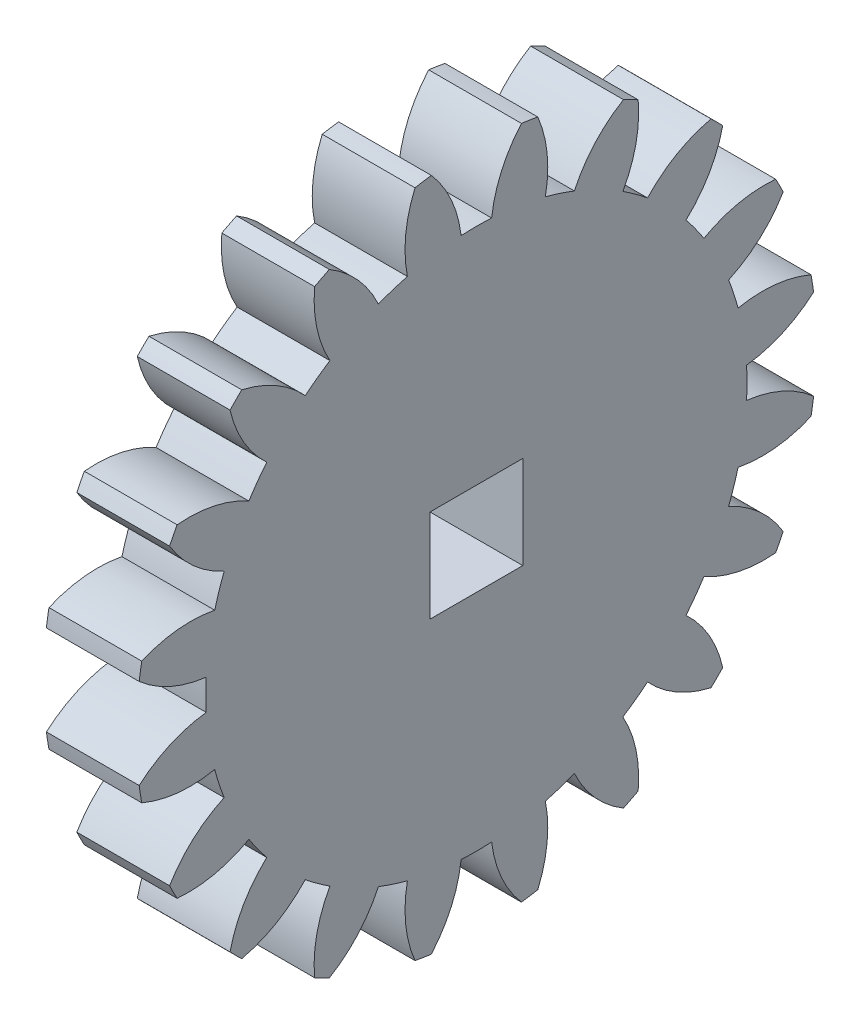
from build123d import *

# Parameters (mm, degrees)
BASPROSKE_W           = 6
BASPROSKE_H           = 22
TOOTHCUT_DEPTH        = 32.685959036
TEETHCUTS_COUNT       = 20
TEETHCUTS_ANGLE       = 342
BORSKE_R              = 0.5
BORE_DEPTH            = 50.0000508
CORTAR_EXTRUIR1_DEPTH = 10


with BuildPart() as part:
    # BasProSke → Base-Revolve (revolve)
    with BuildSketch(Plane(origin=(0, 0, 0), x_dir=(1, 0, 0), z_dir=(0, 1, 0)), mode=Mode.PRIVATE) as base_revolve_sk:
        with Locations((3, 11)):
            Rectangle(BASPROSKE_W, BASPROSKE_H)
    revolve(base_revolve_sk.sketch.rotate(Axis((-10, 0, 0), (1, 0, 0)), 180), axis=Axis((-10, 0, 0), (1, 0, 0)))

    # TooCutSke → ToothCut (cut, through all)
    with BuildSketch(Plane(origin=(0, 0, 0), x_dir=(0, 0, -1), z_dir=(1, 0, 0))):
        with BuildLine():
            ThreePointArc((0.986171591, 17.471189616), (0, 17.499), (-0.986171591, 17.471189616))
            ThreePointArc((-0.986171591, 17.471189616), (-1.626916196, 19.798789858), (-2.932850173, 21.829260982))
            ThreePointArc((-2.932850173, 21.829260982), (0, 22.0254), (2.932850173, 21.829260982))
            ThreePointArc((2.932850173, 21.829260982), (1.626916196, 19.798789858), (0.986171591, 17.471189616))
        make_face()
    toothcut = extrude(amount=TOOTHCUT_DEPTH, mode=Mode.SUBTRACT)

    # TeethCuts: ToothCut ×20 about axis
    teethcuts_axis = Axis((-10, 0, 0), (1, 0, 0))
    for i in range(1, TEETHCUTS_COUNT):
        add(toothcut.rotate(teethcuts_axis, i * TEETHCUTS_ANGLE / (TEETHCUTS_COUNT - 1)), mode=Mode.SUBTRACT)

    # BorSke → Bore (cut, symmetric)
    with BuildSketch(Plane(origin=(0, 0, 0), x_dir=(0, 0, -1), z_dir=(1, 0, 0))):
        with Locations(Location((0, 0, 0), (0, 0, 180))):
            Circle(BORSKE_R)
    extrude(amount=BORE_DEPTH, both=True, mode=Mode.SUBTRACT)

    # Croquis1 → Cortar-Extruir1 (cut)
    with BuildSketch(Plane(origin=(6, 0, 0), x_dir=(0, 0, -1), z_dir=(1, 0, 0))):
        Polygon((0, 3), (-3, 3), (-3, -3), (3, -3), (3, 3), align=None)
    extrude(amount=-CORTAR_EXTRUIR1_DEPTH, mode=Mode.SUBTRACT)


solid = part.part
